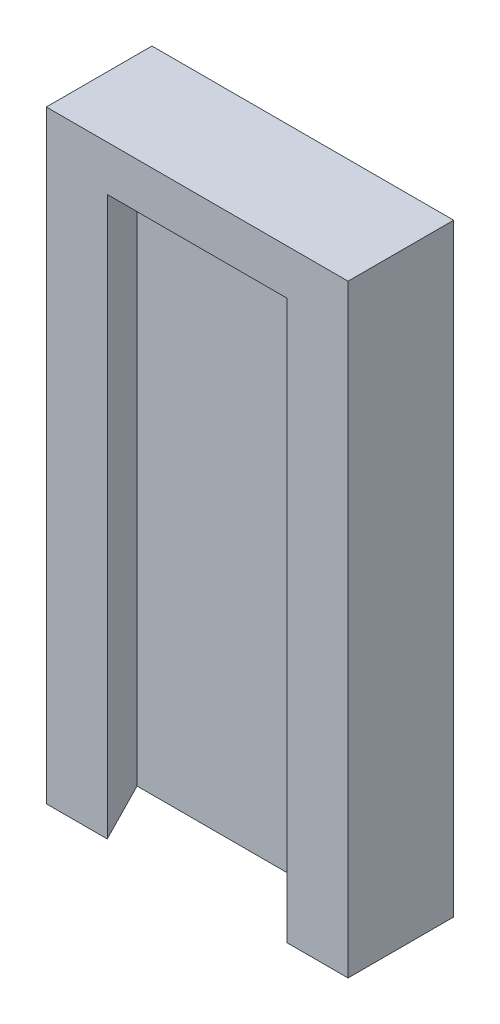
from build123d import *

# Parameters (mm, degrees)
SKETCH1_W           = 40
SKETCH1_H           = 14
BOSS_EXTRUDE1_DEPTH = 40
CUT_EXTRUDE1_DEPTH  = 74


with BuildPart() as part:
    # Sketch1 → Boss-Extrude1 (new, symmetric)
    with BuildSketch(Plane(origin=(0, 0, 0), x_dir=(1, 0, 0), z_dir=(0, 1, 0))):
        Rectangle(SKETCH1_W, SKETCH1_H)
    extrude(amount=BOSS_EXTRUDE1_DEPTH, both=True)

    # Sketch3 → Cut-Extrude1 (cut)
    with BuildSketch(Plane(origin=(0, 34, 0), x_dir=(1, 0, 0), z_dir=(0, 1, 0))):
        Polygon((-16.025, 1.05), (16.025, 1.05), (11.923320132, -7), (-11.923320132, -7), align=None)
    extrude(amount=-CUT_EXTRUDE1_DEPTH, mode=Mode.SUBTRACT)


solid = part.part
